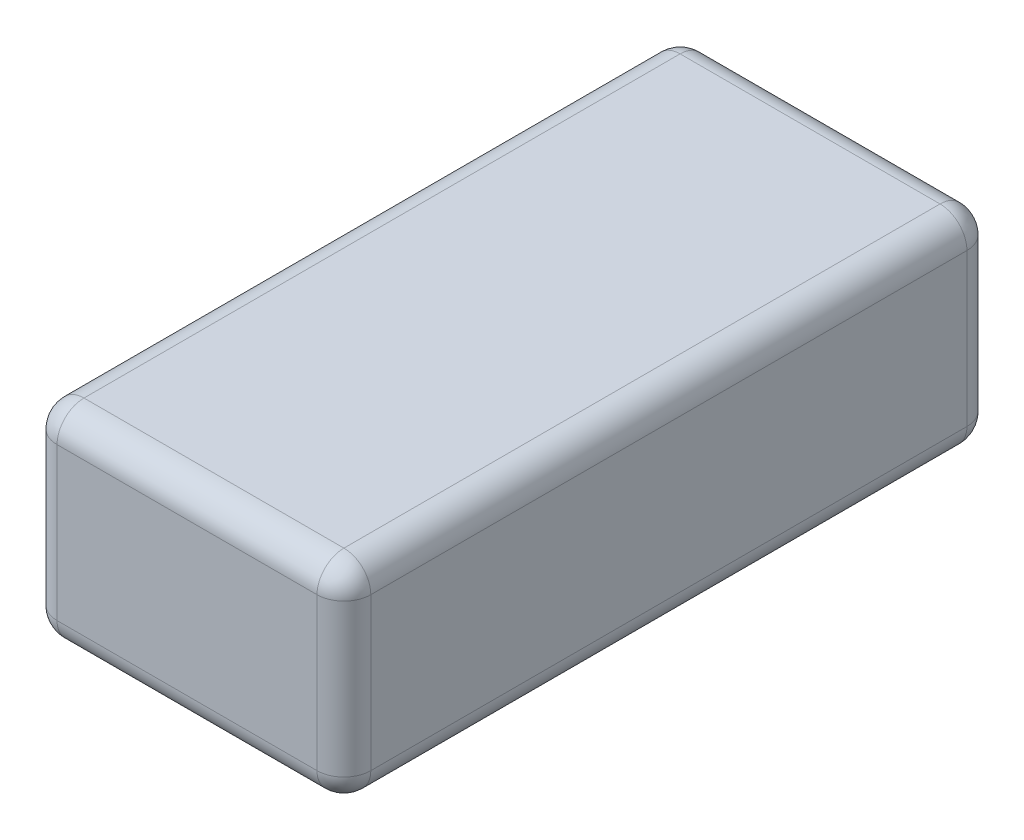
from build123d import *

# Parameters (mm, degrees)
SKETCH1_W           = 35
SKETCH1_H           = 72.5
BOSS_EXTRUDE1_DEPTH = 23
FILLET1_R           = 3


with BuildPart() as part:
    # Sketch1 → Boss-Extrude1 (new body)
    with BuildSketch(Plane(origin=(0, 0, 0), x_dir=(1, 0, 0), z_dir=(0, 1, 0))):
        Rectangle(SKETCH1_W, SKETCH1_H)
    extrude(amount=BOSS_EXTRUDE1_DEPTH)

    # Fillet1
    fillet1_edges = [part.edges().sort_by_distance(p)[0] for p in [
        (-17.5, 23, 0),
        (0, 23, 36.25),
        (17.5, 23, 0),
        (0, 0, 36.25),
        (-17.5, 0, 0),
        (0, 0, -36.25),
        (17.5, 0, 0),
        (0, 23, -36.25),
        (17.5, 11.5, 36.25),
        (-17.5, 11.5, 36.25),
        (-17.5, 11.5, -36.25),
        (17.5, 11.5, -36.25),
    ]]
    fillet(fillet1_edges, radius=FILLET1_R)


solid = part.part
